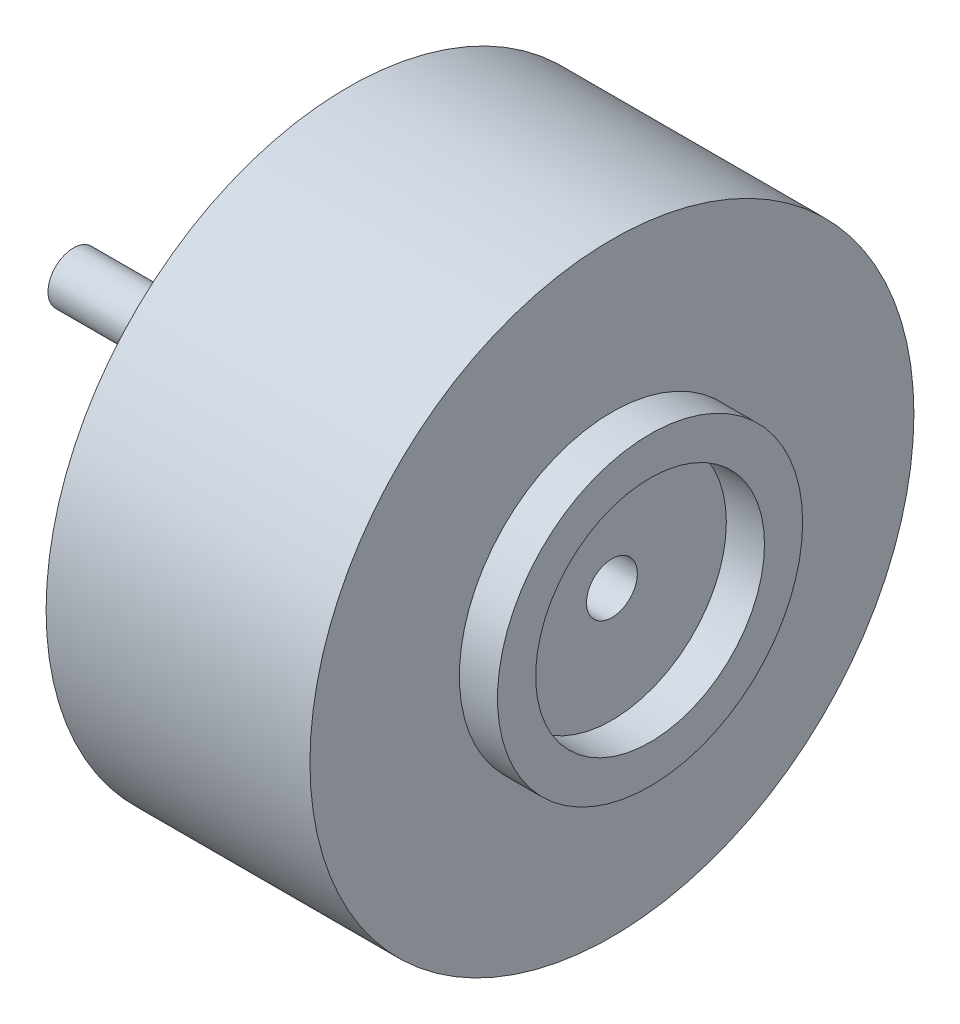
from build123d import *

# Parameters (mm, degrees)
SKETCH1_R           = 23.75
SKETCH1_R_2         = 3
BOSS_EXTRUDE1_DEPTH = 20.75
BOSS_EXTRUDE2_START = -20.75
SKETCH4_R           = 3
SKETCH4_R_2         = 2
BOSS_EXTRUDE2_DEPTH = 20.75
SKETCH5_R           = 12
SKETCH5_R_2         = 9
BOSS_EXTRUDE3_DEPTH = 3
BOSS_EXTRUDE4_START = -3
SKETCH6_R           = 12
SKETCH6_R_2         = 9
BOSS_EXTRUDE4_DEPTH = 3
SKETCH7_R           = 2
SKETCH7_R_2         = 1
BOSS_EXTRUDE6_DEPTH = 21.6


with BuildPart() as part:
    # Sketch1 → Boss-Extrude1 (new body)
    with BuildSketch(Plane(origin=(0, 0, 0), x_dir=(0, 0, -1), z_dir=(1, 0, 0))):
        Circle(SKETCH1_R)
        Circle(SKETCH1_R_2, mode=Mode.SUBTRACT)
    extrude(amount=BOSS_EXTRUDE1_DEPTH)

    # Sketch4 → Boss-Extrude2 (add)
    with BuildSketch(Plane(origin=(20.75, 0, 0), x_dir=(0, 0, -1), z_dir=(1, 0, 0)).offset(BOSS_EXTRUDE2_START)):
        Circle(SKETCH4_R)
        Circle(SKETCH4_R_2, mode=Mode.SUBTRACT)
    extrude(amount=BOSS_EXTRUDE2_DEPTH)

    # Sketch5 → Boss-Extrude3 (add)
    with BuildSketch(Plane(origin=(20.75, 0, 0), x_dir=(0, 0, -1), z_dir=(1, 0, 0))):
        Circle(SKETCH5_R)
        Circle(SKETCH5_R_2, mode=Mode.SUBTRACT)
    extrude(amount=BOSS_EXTRUDE3_DEPTH)

    # Sketch6 → Boss-Extrude4 (add)
    with BuildSketch(Plane(origin=(0, 0, 0), x_dir=(0, 0, -1), z_dir=(1, 0, 0)).offset(BOSS_EXTRUDE4_START)):
        Circle(SKETCH6_R)
        Circle(SKETCH6_R_2, mode=Mode.SUBTRACT)
    extrude(amount=BOSS_EXTRUDE4_DEPTH)


with BuildPart() as body_2:
    # Sketch7 → Boss-Extrude6 (new body)
    with BuildSketch(Plane(origin=(0, 0, 0), x_dir=(0, 0, -1), z_dir=(1, 0, 0))):
        Circle(SKETCH7_R)
        Circle(SKETCH7_R_2, mode=Mode.SUBTRACT)
    extrude(amount=-BOSS_EXTRUDE6_DEPTH)


solid = Compound([part.part, body_2.part])
